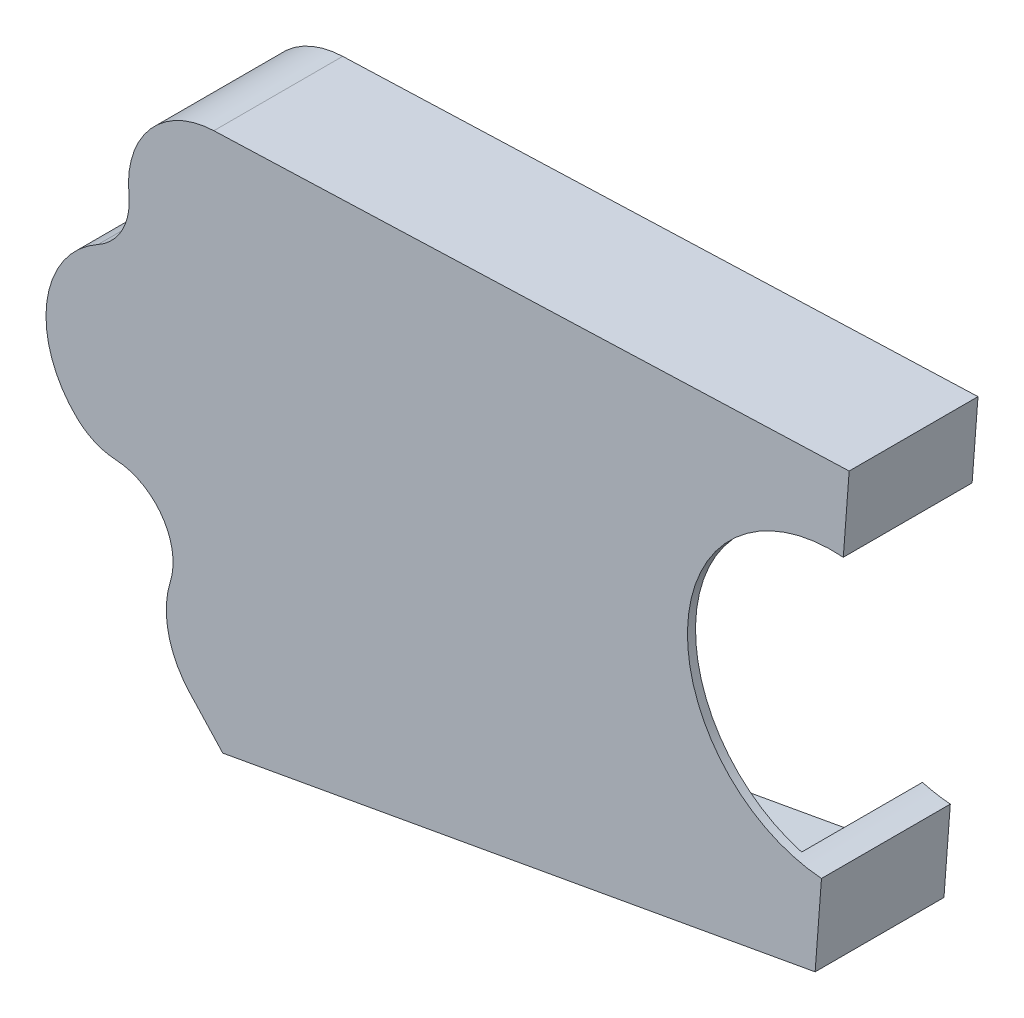
from build123d import *

# Parameters (mm, degrees)
BOSS_EXTRUDE1_DEPTH = 30
BOSS_EXTRUDE2_DEPTH = 2


with BuildPart() as part:
    # Sketch1 → Boss-Extrude1 (new body)
    with BuildSketch(Plane.XY):
        with BuildLine():
            ThreePointArc((-124.422839539, -52.93360637), (-124.888175134, -64.31939994), (-119.594822483, -74.410646153))
            Line((-119.594822483, -74.410646153), (-111.407238253, -83.286865316))
            Line((-111.407238253, -83.286865316), (35.730934718, -56.776536745))
            Line((35.730934718, -56.776536745), (37.30735825, -35.897821688))
            ThreePointArc((37.30735825, -35.897821688), (33.813482954, -35.461340503), (30.378958676, -34.685632184))
            Line((30.378958676, -34.685632184), (29.158639343, -50.847976334))
            Line((29.158639343, -50.847976334), (-108.867065108, -75.716483958))
            Line((-108.867065108, -75.716483958), (-114.449508902, -69.664516346))
            ThreePointArc((-114.449508902, -69.664516346), (-118.058612981, -62.784121201), (-117.741338712, -55.021080131))
            ThreePointArc((-117.741338712, -55.021080131), (-120.686835144, -35.887822689), (-137.611023, -26.489452883))
            ThreePointArc((-137.611023, -26.489452883), (-140.360427807, -25.849420576), (-142.716361529, -24.294285714))
            ThreePointArc((-142.716361529, -24.294285714), (-148.157403518, -8.953967174), (-139.001078611, 4.503076521))
            ThreePointArc((-139.001078611, 4.503076521), (-130.143335416, 13.552732011), (-127.741520279, 25.986040624))
            ThreePointArc((-127.741520279, 25.986040624), (-124.12688517, 37.354531527), (-113.359672518, 42.490220779))
            Line((-113.359672518, 42.490220779), (36.615125644, 47.908385572))
            Line((36.615125644, 47.908385572), (35.69634188, 35.73968597))
            ThreePointArc((35.69634188, 35.73968597), (39.20840278, 35.99090031), (42.728206295, 35.897821688))
            Line((42.728206295, 35.897821688), (44.184569482, 55.186414758))
            Line((44.184569482, 55.186414758), (-113.612397826, 49.485657143))
            ThreePointArc((-113.612397826, 49.485657143), (-129.404309715, 41.953312906), (-134.705774542, 25.279526249))
            ThreePointArc((-134.705774542, 25.279526249), (-136.343375771, 16.802270376), (-142.382746132, 10.632050724))
            ThreePointArc((-142.382746132, 10.632050724), (-155.099864059, -8.058287742), (-147.542861296, -29.364285714))
            ThreePointArc((-147.542861296, -29.364285714), (-143.125485566, -32.280163581), (-137.970351553, -33.480224156))
            ThreePointArc((-137.970351553, -33.480224156), (-126.431132561, -39.888203569), (-124.422839539, -52.93360637))
        make_face()
    extrude(amount=BOSS_EXTRUDE1_DEPTH)

    # Sketch4 → Boss-Extrude2 (add)
    with BuildSketch(Plane.XY.offset(30)):
        with BuildLine():
            ThreePointArc((37.30735825, -35.897821688), (4.119960585, 2.710424022), (42.728206295, 35.897821688))
            Line((42.728206295, 35.897821688), (44.184569482, 55.186414758))
            Line((44.184569482, 55.186414758), (-113.612397826, 49.485657143))
            ThreePointArc((-113.612397826, 49.485657143), (-129.404309715, 41.953312906), (-134.705774542, 25.279526249))
            ThreePointArc((-134.705774542, 25.279526249), (-136.343375771, 16.802270376), (-142.382746132, 10.632050724))
            ThreePointArc((-142.382746132, 10.632050724), (-155.099864059, -8.058287742), (-147.542861296, -29.364285714))
            ThreePointArc((-147.542861296, -29.364285714), (-143.125485566, -32.280163581), (-137.970351553, -33.480224156))
            ThreePointArc((-137.970351553, -33.480224156), (-126.431132561, -39.888203569), (-124.422839539, -52.93360637))
            ThreePointArc((-124.422839539, -52.93360637), (-124.888175134, -64.31939994), (-119.594822483, -74.410646153))
            Line((-119.594822483, -74.410646153), (-111.407238253, -83.286865316))
            Line((-111.407238253, -83.286865316), (35.730934718, -56.776536745))
            Line((35.730934718, -56.776536745), (37.30735825, -35.897821688))
        make_face()
    extrude(amount=BOSS_EXTRUDE2_DEPTH)


solid = part.part
